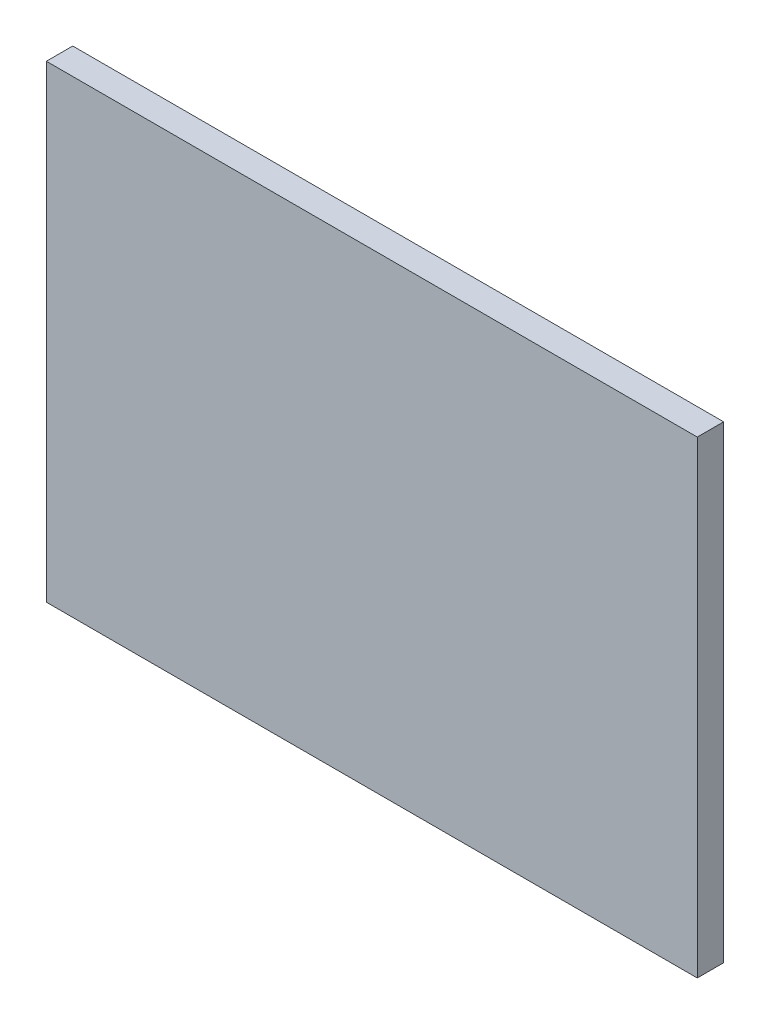
from build123d import *

# Parameters (mm, degrees)
ESBO_O1_W                = 370
ESBO_O1_H                = 266.3
RESSALTO_EXTRUS_O1_DEPTH = 15


with BuildPart() as part:
    # Esboço1 → Ressalto-extrusão1 (new body)
    with BuildSketch(Plane.XY):
        Rectangle(ESBO_O1_W, ESBO_O1_H)
    extrude(amount=RESSALTO_EXTRUS_O1_DEPTH)


solid = part.part
